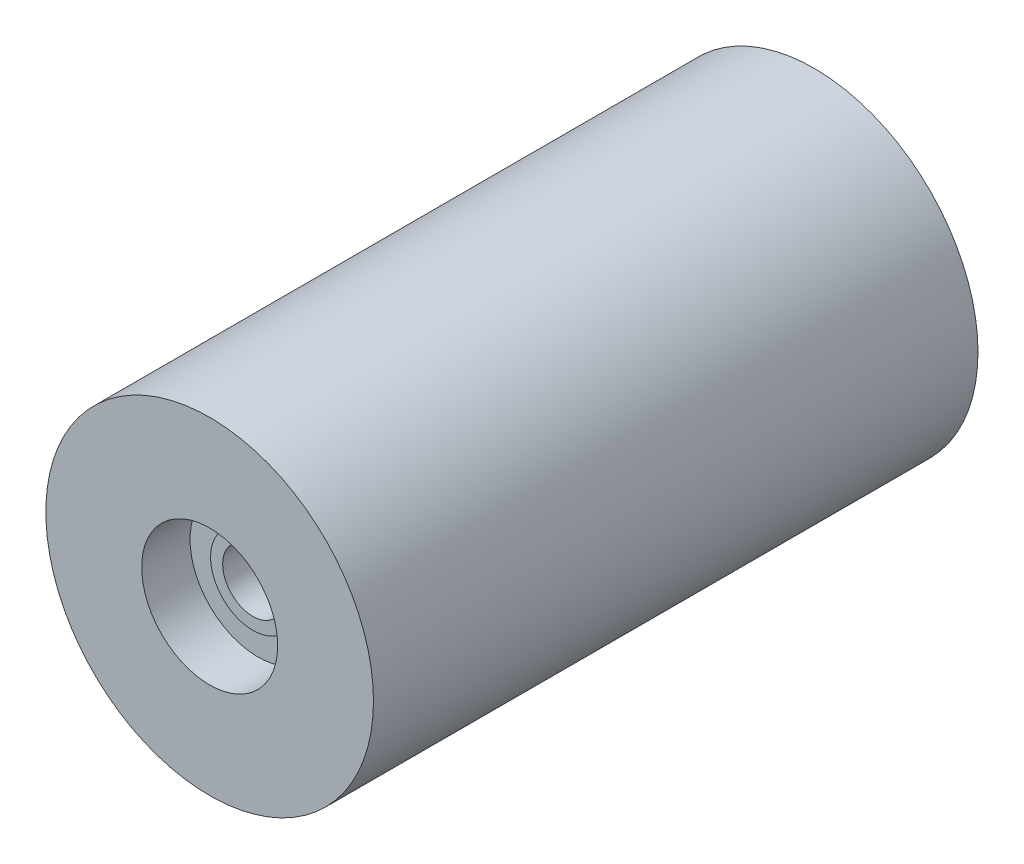
from build123d import *

# Parameters (mm, degrees)
SKETCH1_R           = 27.1
SKETCH1_R_2         = 5
BOSS_EXTRUDE1_DEPTH = 100
CUT_EXTRUDE1_START  = -7.15
SKETCH2_R           = 7
SKETCH2_R_2         = 5
CUT_EXTRUDE1_DEPTH  = 7.15
CUT_EXTRUDE2_START  = -8
SKETCH3_R           = 11.25
SKETCH3_R_2         = 7
CUT_EXTRUDE2_DEPTH  = 8
SKETCH4_R           = 7
CUT_EXTRUDE3_DEPTH  = 7.15
SKETCH5_R           = 11.25
SKETCH5_R_2         = 7
CUT_EXTRUDE4_DEPTH  = 8


with BuildPart() as part:
    # Sketch1 → Boss-Extrude1 (new body)
    with BuildSketch(Plane.XY):
        Circle(SKETCH1_R)
        Circle(SKETCH1_R_2, mode=Mode.SUBTRACT)
    extrude(amount=BOSS_EXTRUDE1_DEPTH)

    # Sketch2 → Cut-Extrude1 (cut)
    with BuildSketch(Plane.XY.offset(100).offset(CUT_EXTRUDE1_START)):
        Circle(SKETCH2_R)
        Circle(SKETCH2_R_2, mode=Mode.SUBTRACT)
    extrude(amount=CUT_EXTRUDE1_DEPTH, mode=Mode.SUBTRACT)

    # Sketch3 → Cut-Extrude2 (cut)
    with BuildSketch(Plane.XY.offset(100).offset(CUT_EXTRUDE2_START)):
        Circle(SKETCH3_R)
        Circle(SKETCH3_R_2, mode=Mode.SUBTRACT)
    extrude(amount=CUT_EXTRUDE2_DEPTH, mode=Mode.SUBTRACT)

    # Sketch4 → Cut-Extrude3 (cut)
    with BuildSketch(Plane(origin=(0, 0, 0), x_dir=(-1, 0, 0), z_dir=(0, 0, -1))):
        with Locations(Location((0, 0, 0), (0, 0, 180))):
            Circle(SKETCH4_R)
    extrude(amount=-CUT_EXTRUDE3_DEPTH, mode=Mode.SUBTRACT)

    # Sketch5 → Cut-Extrude4 (cut)
    with BuildSketch(Plane(origin=(0, 0, 0), x_dir=(-1, 0, 0), z_dir=(0, 0, -1))):
        with Locations(Location((0, 0, 0), (0, 0, 180))):
            Circle(SKETCH5_R)
        with Locations(Location((0, 0, 0), (0, 0, 180))):
            Circle(SKETCH5_R_2, mode=Mode.SUBTRACT)
    extrude(amount=-CUT_EXTRUDE4_DEPTH, mode=Mode.SUBTRACT)


solid = part.part
